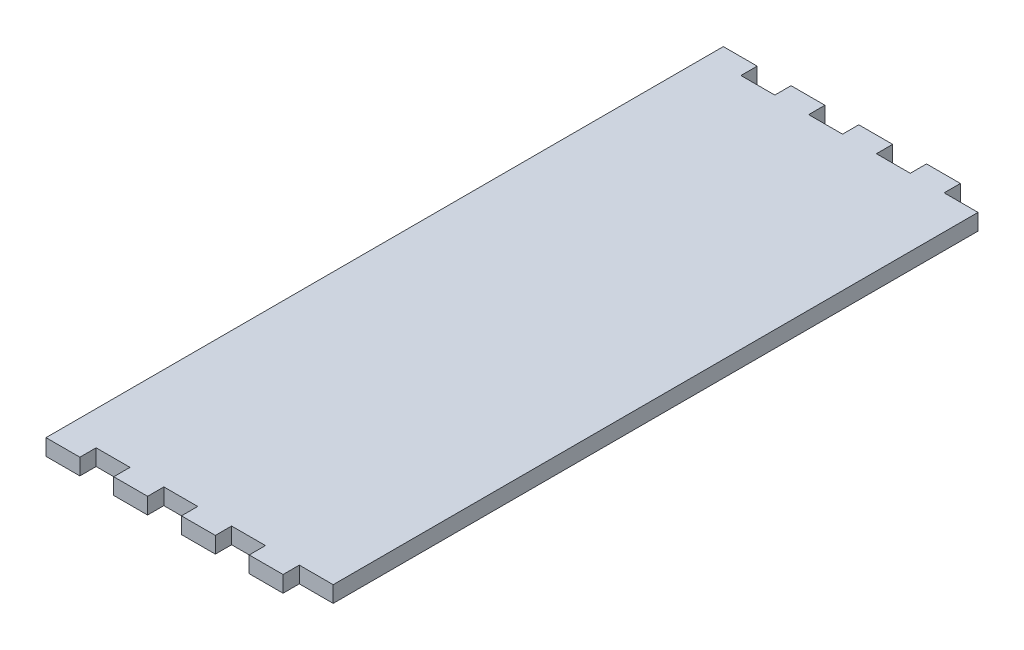
from build123d import *

# Parameters (mm, degrees)
BOSS_EXTRUDE1_DEPTH = 3.048


with BuildPart() as part:
    # Sketch1 → Boss-Extrude1 (new body)
    with BuildSketch(Plane(origin=(0, 0, 0), x_dir=(1, 0, 0), z_dir=(0, 1, 0))):
        Polygon((6.35, 0), (0, 0), (0, -63.5), (50.8, -63.5), (50.8, -3.048), (44.45, -3.048), (44.45, 0), (38.1, 0), (38.1, -3.048), (31.75, -3.048), (31.75, 0), (25.4, 0), (25.4, -3.048), (19.05, -3.048), (19.05, 0), (12.7, 0), (12.7, -3.048), (6.35, -3.048), align=None)
        Polygon((50.8, -63.5), (0, -63.5), (0, -127), (6.35, -127), (6.35, -123.952), (12.7, -123.952), (12.7, -127), (19.05, -127), (19.05, -123.952), (25.4, -123.952), (25.4, -127), (31.75, -127), (31.75, -123.952), (38.1, -123.952), (38.1, -127), (44.45, -127), (44.45, -123.952), (50.8, -123.952), align=None)
    extrude(amount=BOSS_EXTRUDE1_DEPTH)


solid = part.part
